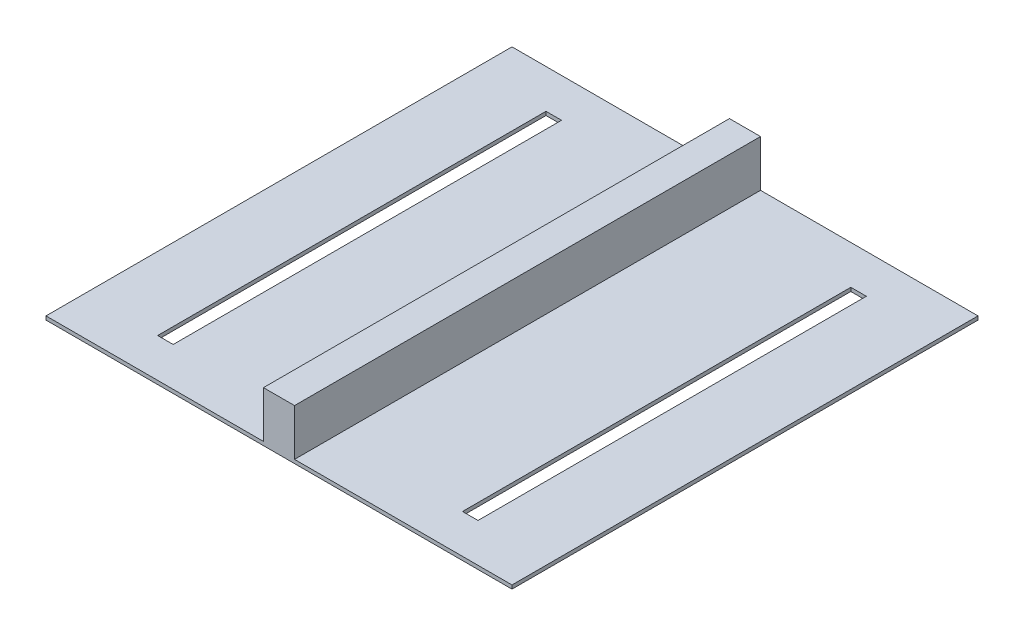
from build123d import *

# Parameters (mm, degrees)
SKETCH1_W           = 762
SKETCH1_H           = 762
SKETCH1_W_2         = 25.4
SKETCH1_H_2         = 635
BOSS_EXTRUDE1_DEPTH = 3
SKETCH2_W           = 50.8
SKETCH2_H           = 762
BOSS_EXTRUDE2_DEPTH = 76.2


with BuildPart() as part:
    # Sketch1 → Boss-Extrude1 (new, symmetric)
    with BuildSketch(Plane(origin=(0, 0, 0), x_dir=(1, 0, 0), z_dir=(0, 1, 0))):
        Rectangle(SKETCH1_W, SKETCH1_H)
        with Locations((-249.2248, 0)):
            Rectangle(SKETCH1_W_2, SKETCH1_H_2, mode=Mode.SUBTRACT)
        with Locations((249.2248, 0)):
            Rectangle(SKETCH1_W_2, SKETCH1_H_2, mode=Mode.SUBTRACT)
    extrude(amount=BOSS_EXTRUDE1_DEPTH, both=True)

    # Sketch2 → Boss-Extrude2 (add)
    with BuildSketch(Plane(origin=(0, 3, 0), x_dir=(1, 0, 0), z_dir=(0, 1, 0))):
        Rectangle(SKETCH2_W, SKETCH2_H)
    extrude(amount=BOSS_EXTRUDE2_DEPTH)


solid = part.part
